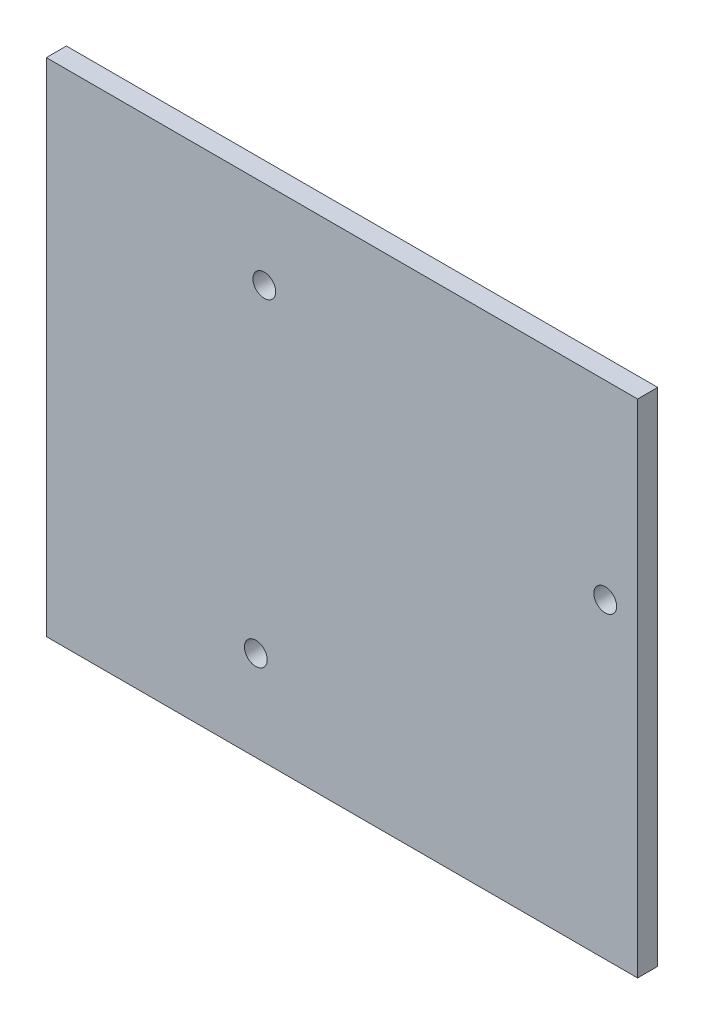
from build123d import *

# Parameters (mm, degrees)
ESQUISSE1_W        = 88.328603511
ESQUISSE1_H        = 74.903508165
BOSS_EXTRU_1_DEPTH = 3
D_GAGEMENT_M31_D   = 3.4


with BuildPart() as part:
    # Esquisse1 → Boss.-Extru.1 (new body)
    with BuildSketch(Plane.XY):
        with Locations((-13.227677397, -0.159821294)):
            Rectangle(ESQUISSE1_W, ESQUISSE1_H)
    extrude(amount=-BOSS_EXTRU_1_DEPTH)

    # Dégagement M31 (through all)
    with Locations(Plane.XY):
        with Locations((26.095, 8.89), (-24.825, 24.13), (-26.095, -24.13)):
            Hole(D_GAGEMENT_M31_D / 2)


solid = part.part
